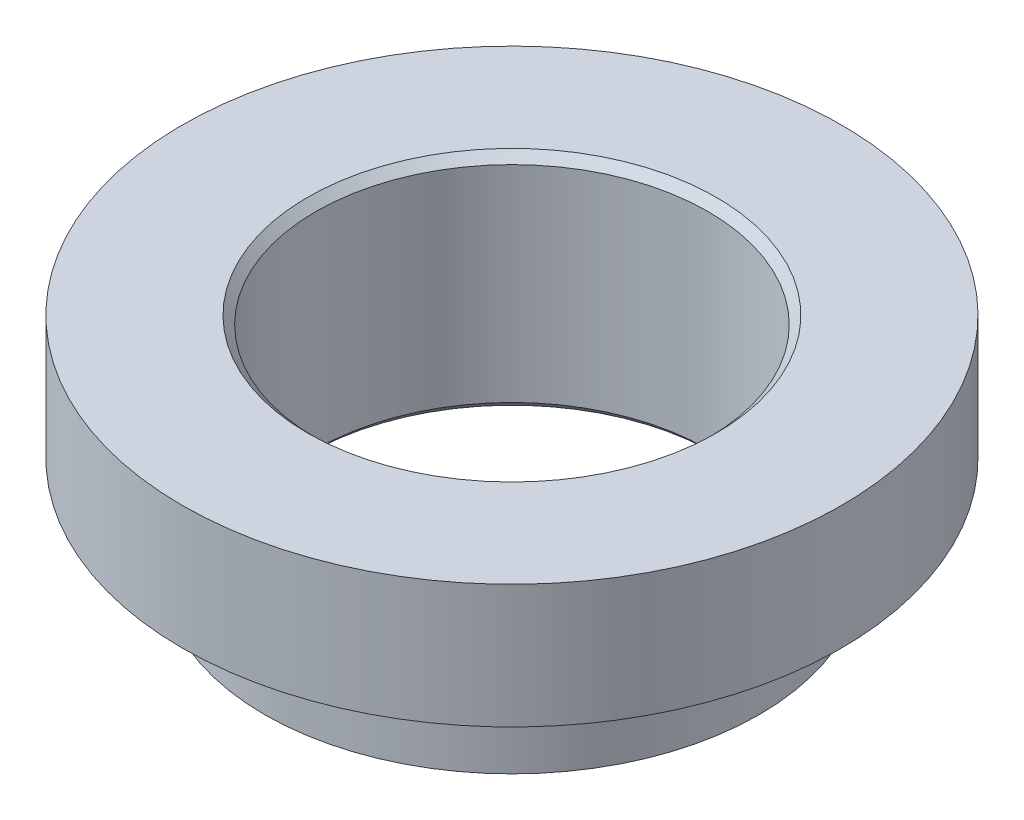
from build123d import *


with BuildPart() as part:
    # Esquisse1 → Révolution1 (revolve)
    with BuildSketch(Plane.XY, mode=Mode.PRIVATE) as r_volution1_sk:
        Polygon((-12.4, 0), (-20, 0), (-20, -7.5), (-15, -7.5), (-15, -13.5), (-12.4, -13.5), (-11.9, -13), (-11.9, -0.5), align=None)
    revolve(r_volution1_sk.sketch.rotate(Axis((0, 0, 0), (0, -1, 0)), 270), axis=Axis((0, 0, 0), (0, -1, 0)))


solid = part.part
